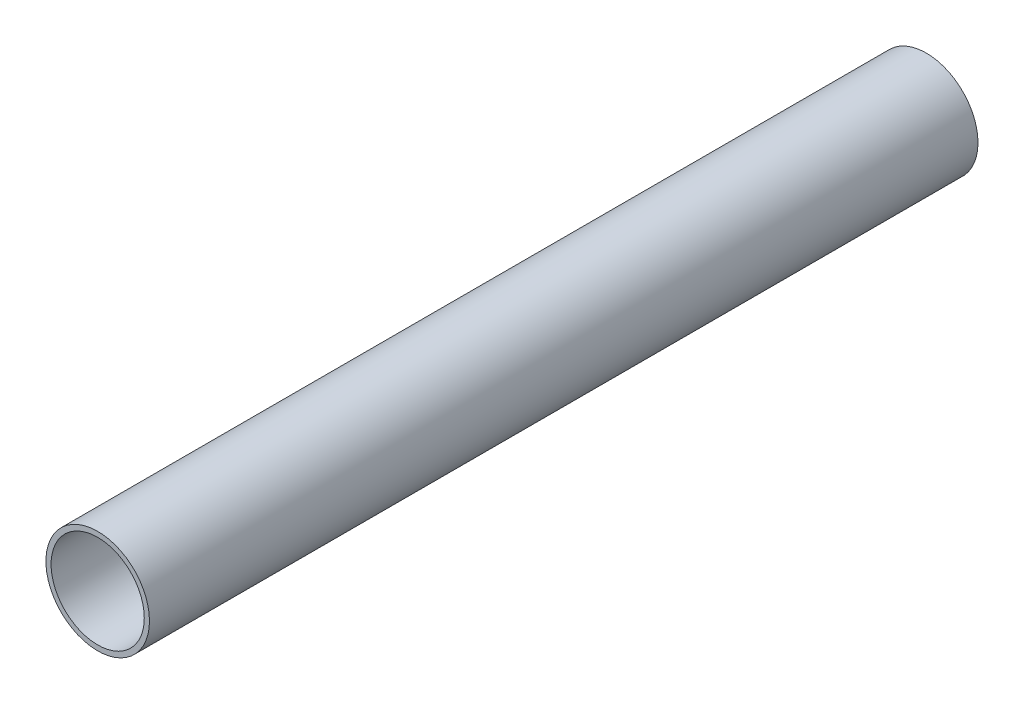
from build123d import *

# Parameters (mm, degrees)
ESQUISSE1_R             = 10
BOSS_EXTRU_1_DEPTH      = 160
ESQUISSE2_R             = 9
ENL_V_MAT_EXTRU_1_DEPTH = 161.623784042


with BuildPart() as part:
    # Esquisse1 → Boss.-Extru.1 (new body)
    with BuildSketch(Plane.XY):
        Circle(ESQUISSE1_R)
    extrude(amount=BOSS_EXTRU_1_DEPTH)

    # Esquisse2 → Enlèv. mat.-Extru.1 (cut, through all)
    with BuildSketch(Plane.XY.offset(160)):
        Circle(ESQUISSE2_R)
    extrude(amount=-ENL_V_MAT_EXTRU_1_DEPTH, mode=Mode.SUBTRACT)


solid = part.part
